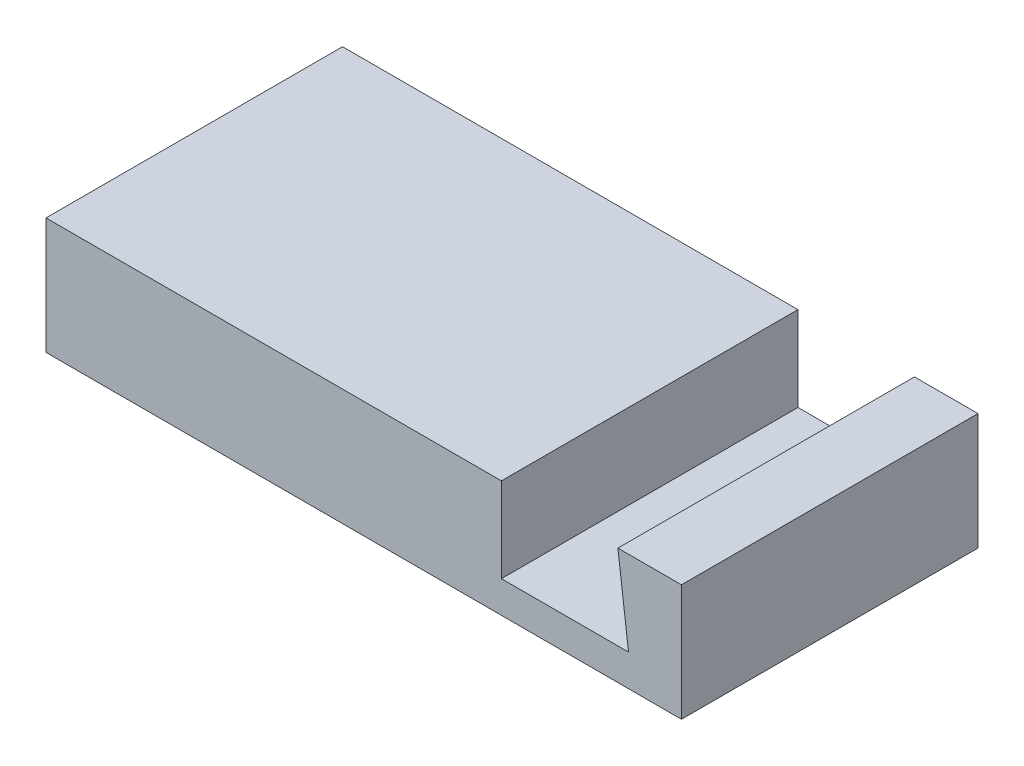
from build123d import *

# Parameters (mm, degrees)
SALIENTE_EXTRUIR1_DEPTH = 28


with BuildPart() as part:
    # Croquis1 → Saliente-Extruir1 (new body)
    with BuildSketch(Plane.XY):
        Polygon((0, 0), (60, 0), (60, 11), (54, 11), (55, 3), (43, 3), (43, 11), (0, 11), align=None)
    extrude(amount=SALIENTE_EXTRUIR1_DEPTH)


solid = part.part
